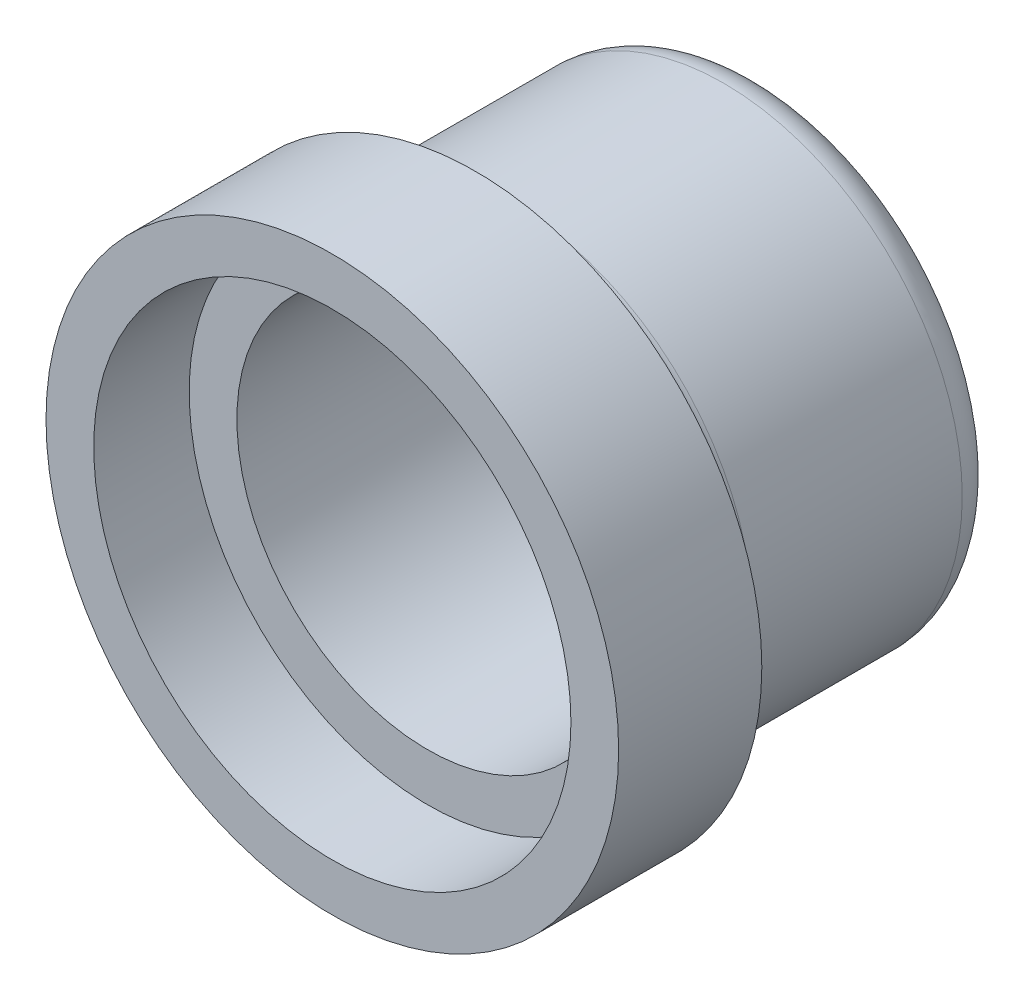
from build123d import *

# Parameters (mm, degrees)
ESBO_O1_R                = 15
RESSALTO_EXTRUS_O1_DEPTH = 7.5
ESBO_O2_R                = 12.5
RESSALTO_EXTRUS_O2_DEPTH = 15
CASCA1_T                 = -2.5
FILETE2_R                = 2


with BuildPart() as part:
    # Esboço1 → Ressalto-extrusão1 (new body)
    with BuildSketch(Plane.XY):
        Circle(ESBO_O1_R)
    extrude(amount=RESSALTO_EXTRUS_O1_DEPTH)

    # Esboço2 → Ressalto-extrusão2 (add)
    with BuildSketch(Plane(origin=(0, 0, 0), x_dir=(-1, 0, 0), z_dir=(0, 0, -1))):
        Circle(ESBO_O2_R)
    extrude(amount=RESSALTO_EXTRUS_O2_DEPTH)

    # Casca1
    casca1_openings = [part.faces().sort_by_distance(p)[0] for p in [
        (0, 0, 7.5),
    ]]
    offset(amount=CASCA1_T, openings=casca1_openings, kind=Kind.INTERSECTION)

    # Filete2
    filete2_edges = [part.edges().sort_by_distance(p)[0] for p in [
        (12.5, 0, 0),
        (12.5, 0, -15),
    ]]
    fillet(filete2_edges, radius=FILETE2_R)


solid = part.part
